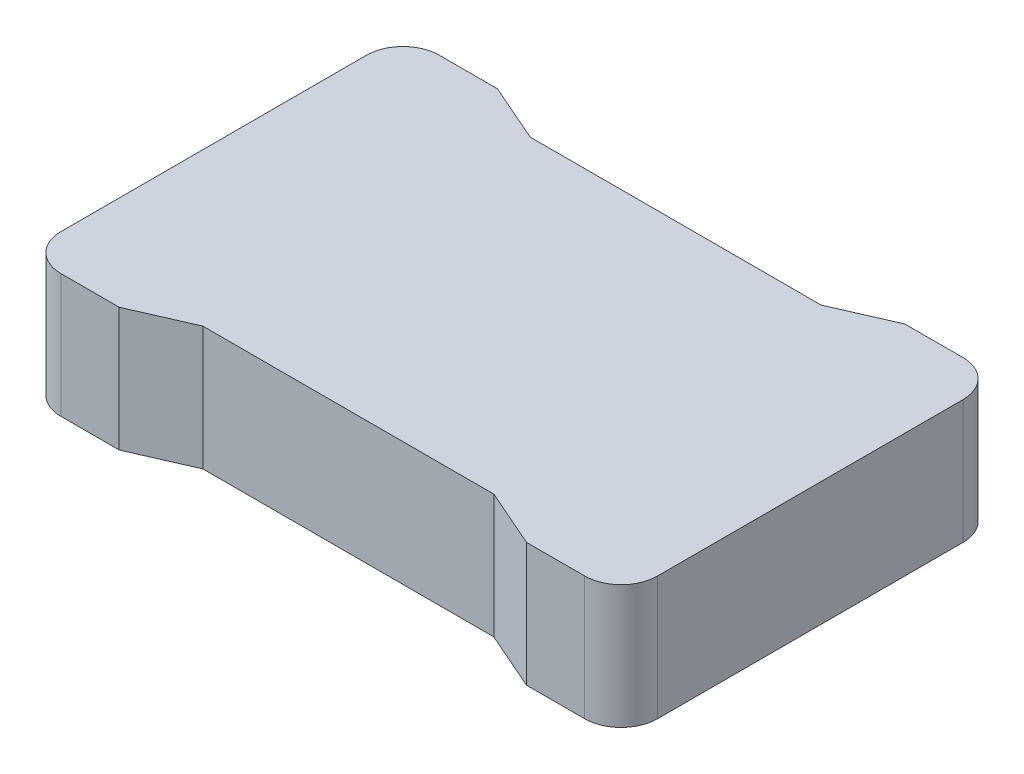
from build123d import *

# Parameters (mm, degrees)
EXTRUDE_1_DEPTH     = 17
CUT_EXTRUDE_1_DEPTH = 10


with BuildPart() as part:
    # 草圖1 → 填料-伸長1 (new body)
    with BuildSketch(Plane(origin=(0, 0, 0), x_dir=(1, 0, 0), z_dir=(0, 1, 0))):
        with BuildLine():
            Line((28, 26), (36, 26))
            ThreePointArc((36, 26), (39.535533906, 24.535533906), (41, 21))
            Line((41, 21), (41, -21))
            ThreePointArc((41, -21), (39.535533906, -24.535533906), (36, -26))
            Line((36, -26), (28, -26))
            Line((28, -26), (20, -22.5))
            Line((20, -22.5), (-20, -22.5))
            Line((-20, -22.5), (-28, -26))
            Line((-28, -26), (-36, -26))
            ThreePointArc((-36, -26), (-39.535533906, -24.535533906), (-41, -21))
            Line((-41, -21), (-41, 21))
            ThreePointArc((-41, 21), (-39.535533906, 24.535533906), (-36, 26))
            Line((-36, 26), (-28, 26))
            Line((-28, 26), (-20, 22.5))
            Line((-20, 22.5), (20, 22.5))
            Line((20, 22.5), (28, 26))
        make_face()
    extrude(amount=EXTRUDE_1_DEPTH)

    # 草圖2 → 除料-伸長1 (cut)
    with BuildSketch(Plane(origin=(0, 0, -22.5), x_dir=(-1, 0, 0), z_dir=(0, 0, -1))):
        with BuildLine():
            Line((14.85, 6.6), (10.15, 6.6))
            ThreePointArc((10.15, 6.6), (8.25, 8.5), (10.15, 10.4))
            Line((10.15, 10.4), (14.85, 10.4))
            ThreePointArc((14.85, 10.4), (16.75, 8.5), (14.85, 6.6))
        make_face()
    extrude(amount=-CUT_EXTRUDE_1_DEPTH, mode=Mode.SUBTRACT)


solid = part.part
